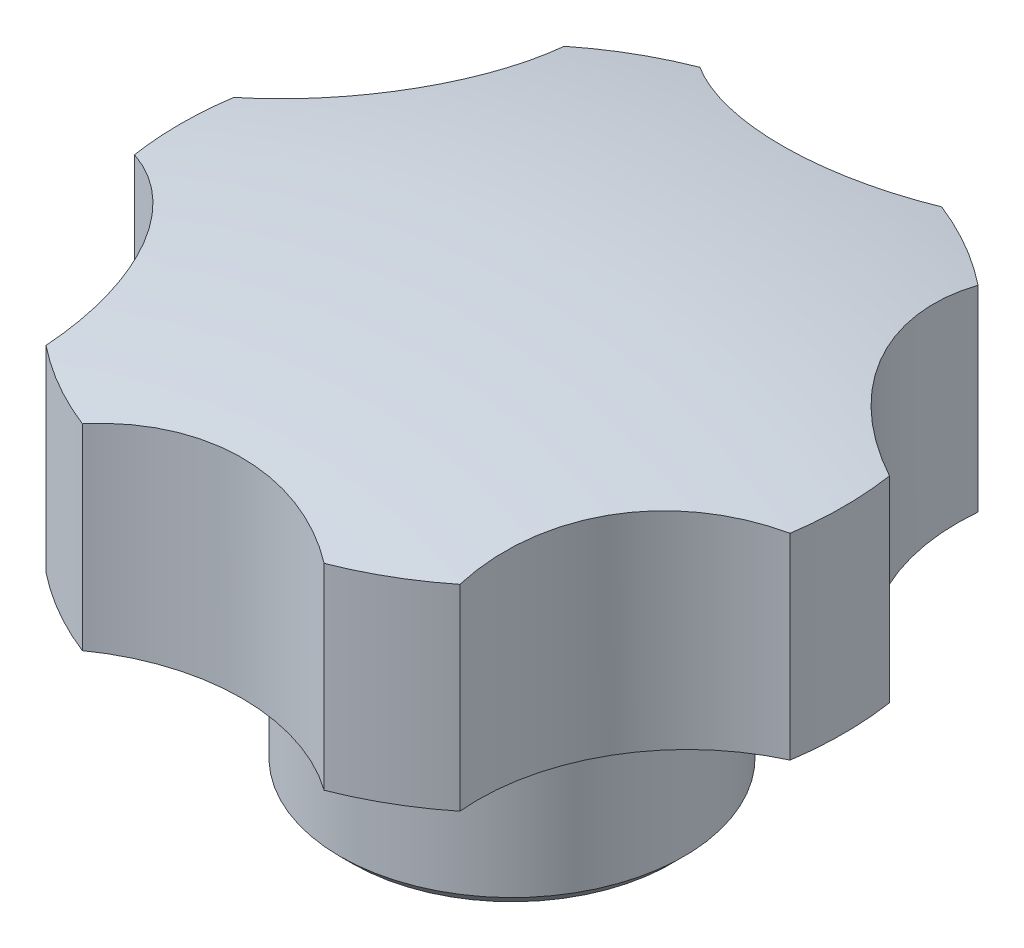
from build123d import *

# Parameters (mm, degrees)
CHAMFER_1_SIZE           = 1
CUT_EXTRUDE_1_DEPTH      = 43.576377572
PATTERN_CIRCULAR_1_COUNT = 6
MM_1_D                   = 10
MM_1_DEPTH               = 20
MM_1_TIP                 = 3.004303095


with BuildPart() as part:
    # 草图1 → 旋转1 (revolve)
    with BuildSketch(Plane.XY, mode=Mode.PRIVATE) as revolve_1_sk:
        with BuildLine():
            Line((0, 17.5), (0, -17.5))
            Line((0, -17.5), (-14, -17.5))
            Line((-14, -17.5), (-14, -3.334753175))
            ThreePointArc((-14, -3.334753175), (-14.585786438, -1.920539613), (-16, -1.334753175))
            Line((-16, -1.334753175), (-27, -1.334753175))
            Line((-27, -1.334753175), (-27, 14.665246825))
            ThreePointArc((-27, 14.665246825), (-13.574201869, 16.789369415), (0, 17.5))
        make_face()
    revolve(revolve_1_sk.sketch.rotate(Axis((0, 51.094488189, 0), (0, -1, 0)), 270), axis=Axis((0, 51.094488189, 0), (0, -1, 0)))

    # 倒角1
    chamfer_1_edges = [part.edges().sort_by_distance(p)[0] for p in [
        (0, -17.5, -14),
    ]]
    chamfer(chamfer_1_edges, length=CHAMFER_1_SIZE)

    # 草图3 → 切除-拉伸1 (cut, through all)
    with BuildSketch(Plane.XZ.offset(1.334753175)):
        with BuildLine():
            ThreePointArc((9.845244015, 25.141025641), (5.009606157, 26.531186294), (0, 27))
            Line((0, 27), (0, 22))
            ThreePointArc((-2.3e-08, 22), (5.167080204, 22.804281981), (9.845244015, 25.141025641))
        make_face()
        with BuildLine():
            Line((0, 22), (0, 27))
            ThreePointArc((0, 27), (-5.009606157, 26.531186294), (-9.845244015, 25.141025641))
            ThreePointArc((-9.845244015, 25.141025641), (-5.167080226, 22.804281988), (-2.3e-08, 22))
        make_face()
    cut_extrude_1 = extrude(amount=-CUT_EXTRUDE_1_DEPTH, mode=Mode.SUBTRACT)

    # 阵列(圆周)1: 切除-拉伸1 ×6 about axis
    pattern_circular_1_axis = Axis((0, 0, 0), (0, 1, 0))
    for i in range(1, PATTERN_CIRCULAR_1_COUNT):
        add(cut_extrude_1.rotate(pattern_circular_1_axis, i * 360 / PATTERN_CIRCULAR_1_COUNT), mode=Mode.SUBTRACT)

    # 大小mm 暗销孔1
    with Locations(Plane(origin=(0, -17.5, 0), x_dir=(-1, 0, 0), z_dir=(0, -1, 0))):
        with Locations((0, 0)):
            Hole(MM_1_D / 2, depth=MM_1_DEPTH)
            with Locations((0, 0, -(MM_1_DEPTH + MM_1_TIP / 2))):  # 118° drill point
                Cone(0, MM_1_D / 2, MM_1_TIP, mode=Mode.SUBTRACT)


solid = part.part
